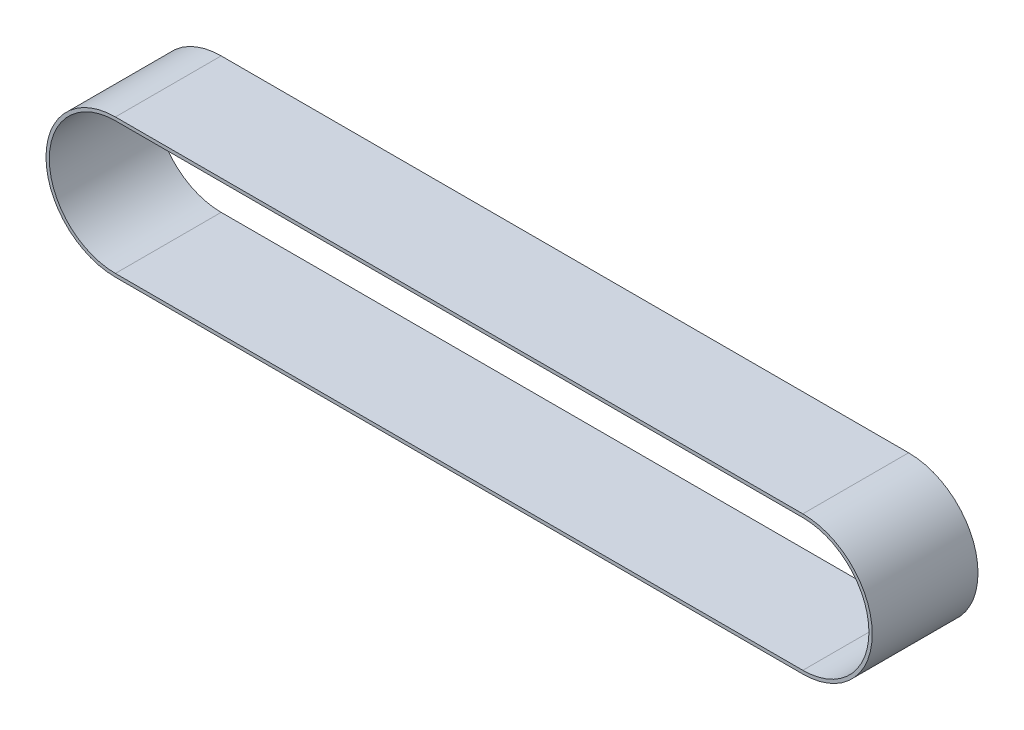
from build123d import *

# Parameters (mm, degrees)
BOSS_EXTRUDE1_DEPTH = 50.8


with BuildPart() as part:
    # Sketch1 → Boss-Extrude1 (new body)
    with BuildSketch(Plane.XY):
        with BuildLine():
            Line((0, 33.3375), (330.2, 33.3375))
            ThreePointArc((330.2, 33.3375), (363.5375, 0), (330.2, -33.3375))
            Line((330.2, -33.3375), (0, -33.3375))
            ThreePointArc((0, -33.3375), (-33.3375, 0), (0, 33.3375))
        make_face()
        with BuildLine():
            Line((0, 31.75), (330.2, 31.75))
            ThreePointArc((330.2, 31.75), (361.95, 0), (330.2, -31.75))
            Line((330.2, -31.75), (0, -31.75))
            ThreePointArc((0, -31.75), (-31.75, 0), (0, 31.75))
        make_face(mode=Mode.SUBTRACT)
    extrude(amount=BOSS_EXTRUDE1_DEPTH)


solid = part.part
